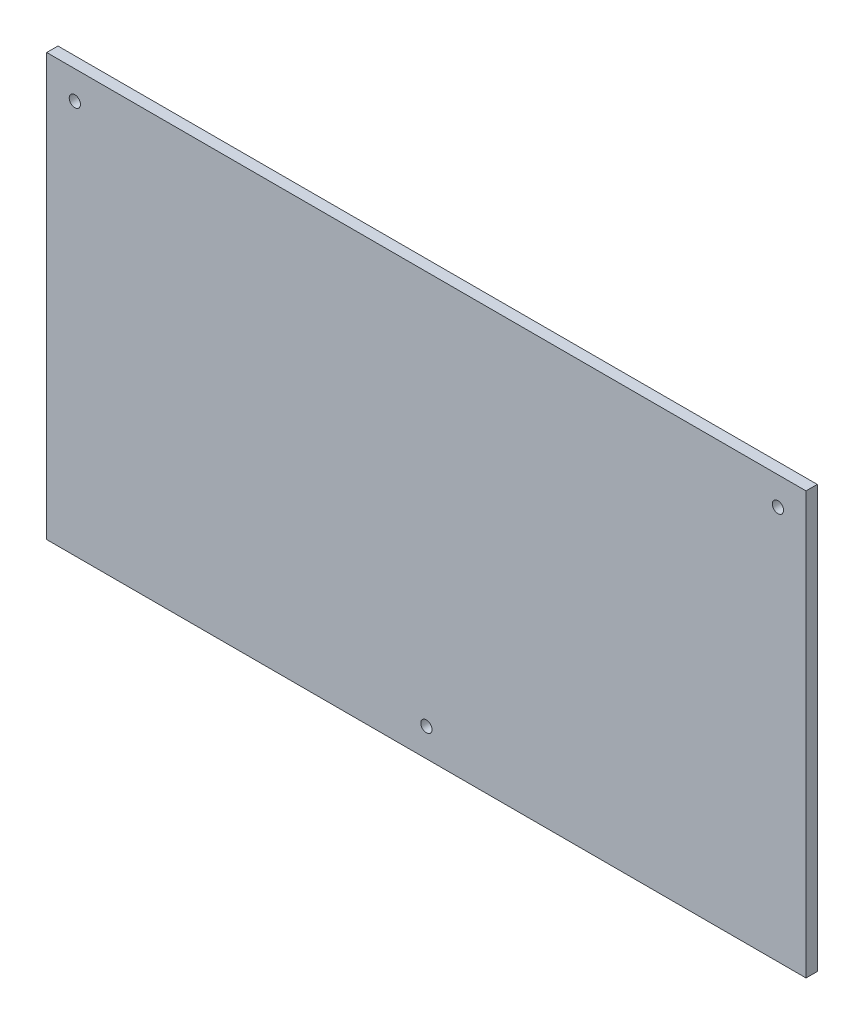
from build123d import *

# Parameters (mm, degrees)
SKETCH2_W           = 270
SKETCH2_H           = 150
SKETCH2_R           = 2
BOSS_EXTRUDE1_DEPTH = 4


with BuildPart() as part:
    # Sketch2 → Boss-Extrude1 (new body)
    with BuildSketch(Plane.XY):
        with Locations((135, 75)):
            Rectangle(SKETCH2_W, SKETCH2_H)
        with Locations((10, 140)):
            Circle(SKETCH2_R, mode=Mode.SUBTRACT)
        with Locations((260, 140)):
            Circle(SKETCH2_R, mode=Mode.SUBTRACT)
        with Locations((135, 10)):
            Circle(SKETCH2_R, mode=Mode.SUBTRACT)
    extrude(amount=BOSS_EXTRUDE1_DEPTH)


solid = part.part
